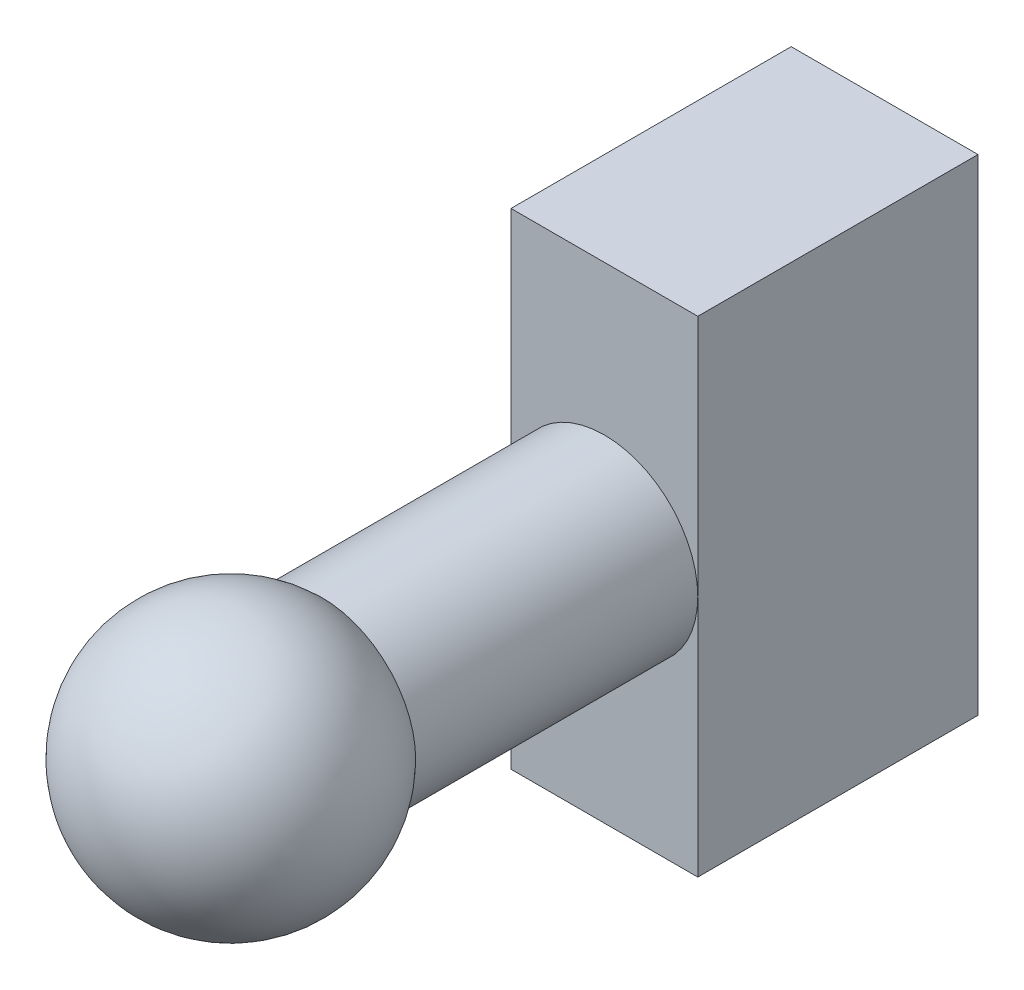
from build123d import *

# Parameters (mm, degrees)
SKETCH1_W           = 10
SKETCH1_H           = 26
BOSS_EXTRUDE1_DEPTH = 15
SKETCH2_R           = 5
BOSS_EXTRUDE2_DEPTH = 20


with BuildPart() as part:
    # Sketch1 → Boss-Extrude1 (new body)
    with BuildSketch(Plane.XY):
        Rectangle(SKETCH1_W, SKETCH1_H)
    extrude(amount=BOSS_EXTRUDE1_DEPTH)

    # Sketch2 → Boss-Extrude2 (add)
    with BuildSketch(Plane.XY.offset(15)):
        Circle(SKETCH2_R)
    extrude(amount=BOSS_EXTRUDE2_DEPTH)

    # Sketch3 → Revolve1 (revolve)
    with BuildSketch(Plane.XY.offset(35)):
        with BuildLine():
            Line((-7, 0), (7, 0))
            ThreePointArc((7, 0), (0, 7), (-7, 0))
        make_face()
    revolve(axis=Axis((-7, 0, 35), (1, 0, 0)))


solid = part.part
